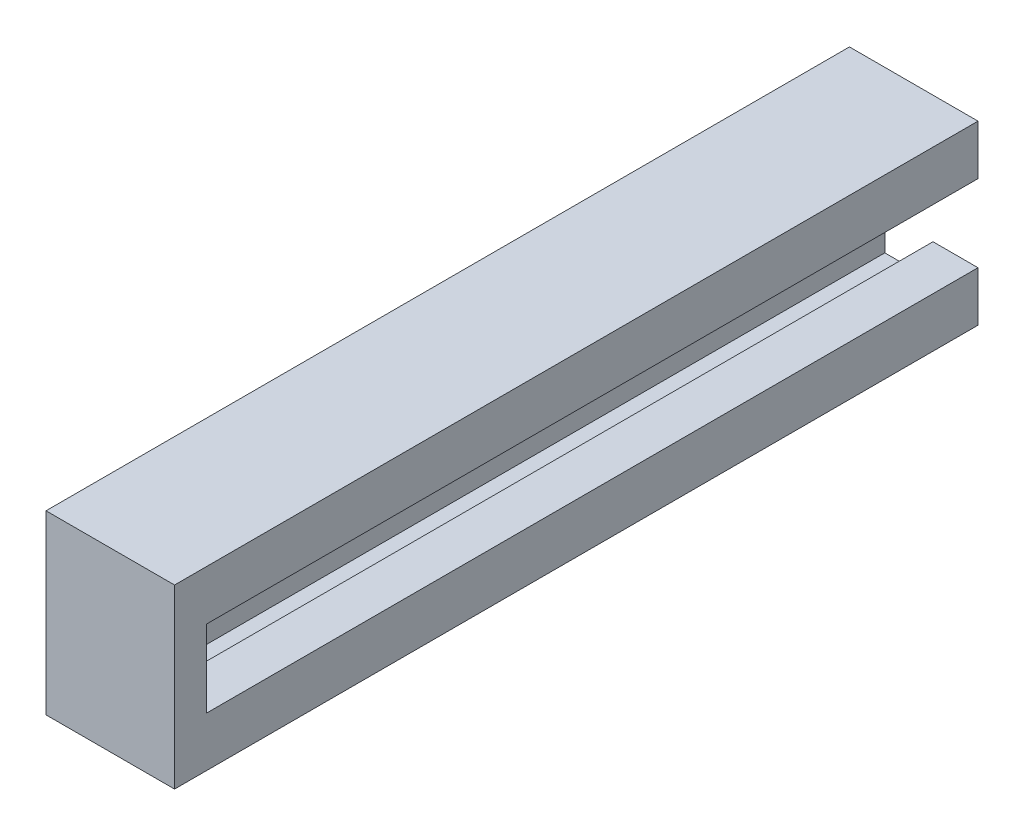
from build123d import *

# Parameters (mm, degrees)
BOSS_EXTRUDE1_DEPTH = 120
SKETCH2_W           = 20
SKETCH2_H           = 27.5
BOSS_EXTRUDE2_DEPTH = 5


with BuildPart() as part:
    # Sketch1 → Boss-Extrude1 (new body)
    with BuildSketch(Plane.XY):
        Polygon((-11.574736842, 6.314736842), (8.425263158, 6.314736842), (8.425263158, -1.435263158), (1.925263158, -1.435263158), (1.925263158, 3.814736842), (-6.074736842, 3.814736842), (-6.074736842, -18.685263158), (1.425263158, -18.685263158), (1.425263158, -13.435263158), (8.425263158, -13.435263158), (8.425263158, -21.185263158), (-11.574736842, -21.185263158), align=None)
    extrude(amount=BOSS_EXTRUDE1_DEPTH)

    # Sketch2 → Boss-Extrude2 (add)
    with BuildSketch(Plane.XY.offset(120)):
        with Locations((-1.574736842, -7.435263158)):
            Rectangle(SKETCH2_W, SKETCH2_H)
    extrude(amount=BOSS_EXTRUDE2_DEPTH)


solid = part.part
